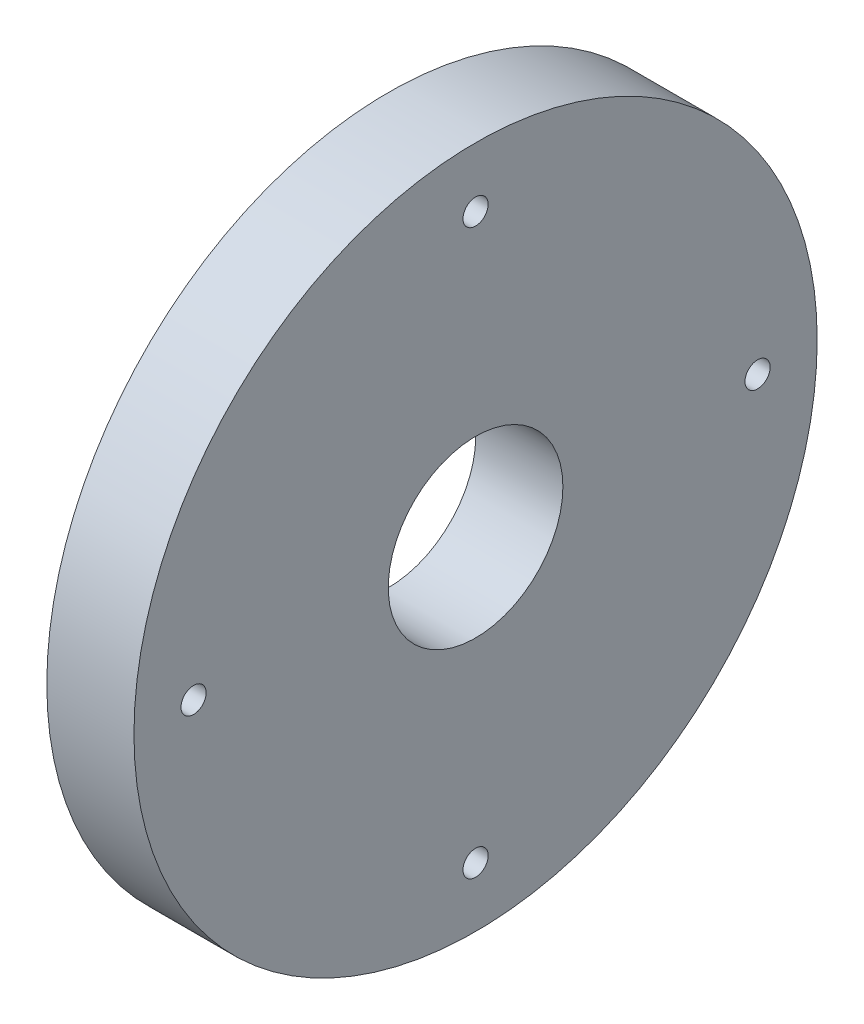
from build123d import *

# Parameters (mm, degrees)
BOSS_EXTRUDE1_DEPTH      = 3.175
BOSS_EXTRUDE1_DEPTH_BACK = 3.175
SKETCH1_R                = 24.892
SKETCH1_R_2              = 6.3627
SKETCH2_R                = 0.916354932
CUT_EXTRUDE1_DEPTH       = 36.77073983
CIRPATTERN1_COUNT        = 4


with BuildPart() as part:
    # Sketch1 → Boss-Extrude1 (new, two sides: drawn at the far end of the back side and taken through both)
    with BuildSketch(Plane(origin=(0, 0, 0), x_dir=(0, 0, -1), z_dir=(1, 0, 0)).offset(-BOSS_EXTRUDE1_DEPTH_BACK)):
        Circle(SKETCH1_R)
        Circle(SKETCH1_R_2, mode=Mode.SUBTRACT)
    extrude(amount=BOSS_EXTRUDE1_DEPTH + BOSS_EXTRUDE1_DEPTH_BACK)

    # Sketch2 → Cut-Extrude1 (cut, symmetric)
    with BuildSketch(Plane(origin=(3.175, 0, 0), x_dir=(0, 0, -1), z_dir=(1, 0, 0))):
        with Locations((0, 20.546808672)):
            Circle(SKETCH2_R)
    cut_extrude1 = extrude(amount=CUT_EXTRUDE1_DEPTH, both=True, mode=Mode.SUBTRACT)

    # CirPattern1: Cut-Extrude1 ×4 about axis
    cirpattern1_axis = Axis((3.175, 0, 0), (1, 0, 0))
    for i in range(1, CIRPATTERN1_COUNT):
        add(cut_extrude1.rotate(cirpattern1_axis, i * 360 / CIRPATTERN1_COUNT), mode=Mode.SUBTRACT)


solid = part.part
